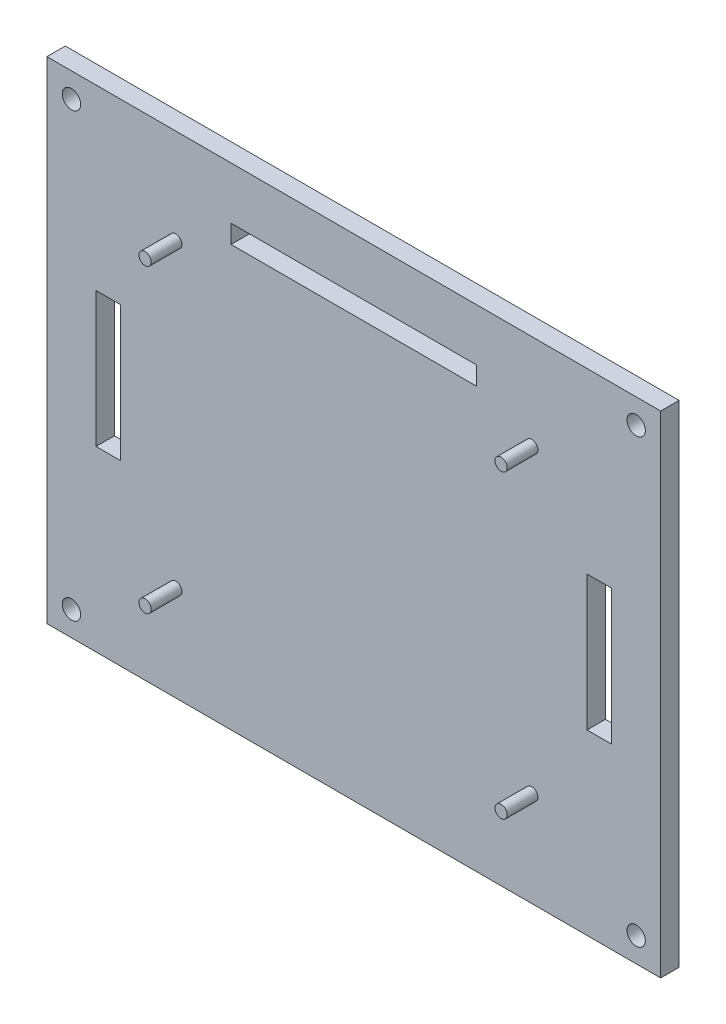
from build123d import *

# Parameters (mm, degrees)
ESQUISSE1_W        = 100
ESQUISSE1_H        = 80
ESQUISSE1_R        = 1.5
ESQUISSE1_W_2      = 4
ESQUISSE1_H_2      = 22
ESQUISSE1_W_3      = 40
ESQUISSE1_H_3      = 3
BOSS_EXTRU_1_DEPTH = 3
ESQUISSE2_R        = 1
BOSS_EXTRU_2_DEPTH = 5


with BuildPart() as part:
    # Esquisse1 → Boss.-Extru.1 (new body)
    with BuildSketch(Plane.XY):
        Rectangle(ESQUISSE1_W, ESQUISSE1_H)
        with Locations((-46, 36)):
            Circle(ESQUISSE1_R, mode=Mode.SUBTRACT)
        with Locations((46, 36)):
            Circle(ESQUISSE1_R, mode=Mode.SUBTRACT)
        with Locations((46, -36)):
            Circle(ESQUISSE1_R, mode=Mode.SUBTRACT)
        with Locations((-46, -36)):
            Circle(ESQUISSE1_R, mode=Mode.SUBTRACT)
        with Locations((-40, 0)):
            Rectangle(ESQUISSE1_W_2, ESQUISSE1_H_2, mode=Mode.SUBTRACT)
        with Locations((40, 0)):
            Rectangle(ESQUISSE1_W_2, ESQUISSE1_H_2, mode=Mode.SUBTRACT)
        with Locations((0, 30)):
            Rectangle(ESQUISSE1_W_3, ESQUISSE1_H_3, mode=Mode.SUBTRACT)
    extrude(amount=BOSS_EXTRU_1_DEPTH)

    # Esquisse2 → Boss.-Extru.2 (add)
    with BuildSketch(Plane.XY.offset(3)):
        with Locations((-29, 24.5)):
            Circle(ESQUISSE2_R)
        with Locations((29, 24.5)):
            Circle(ESQUISSE2_R)
        with Locations((29, -24.5)):
            Circle(ESQUISSE2_R)
        with Locations((-29, -24.5)):
            Circle(ESQUISSE2_R)
    extrude(amount=BOSS_EXTRU_2_DEPTH)


solid = part.part
